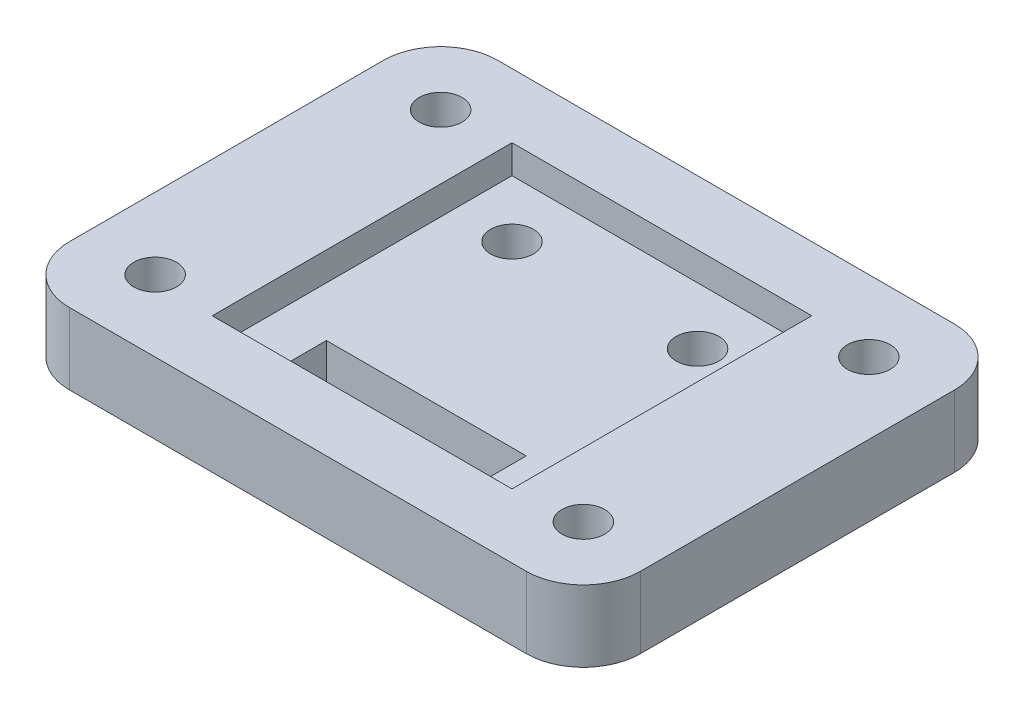
from build123d import *

# Parameters (mm, degrees)
SKETCH1_W           = 40
SKETCH1_H           = 30
BOSS_EXTRUDE1_DEPTH = 5
SKETCH2_W           = 21
SKETCH2_H           = 21
CUT_EXTRUDE1_DEPTH  = 2
SKETCH3_W           = 14
SKETCH3_H           = 3
CUT_EXTRUDE2_DEPTH  = 3
SKETCH4_R           = 1.5
CUT_EXTRUDE3_DEPTH  = 3
SKETCH5_R           = 1.5
CUT_EXTRUDE4_DEPTH  = 5
FILLET1_R           = 4


with BuildPart() as part:
    # Sketch1 → Boss-Extrude1 (new body)
    with BuildSketch(Plane(origin=(0, 0, 0), x_dir=(1, 0, 0), z_dir=(0, 1, 0))):
        with Locations((20, 15)):
            Rectangle(SKETCH1_W, SKETCH1_H)
    extrude(amount=BOSS_EXTRUDE1_DEPTH)

    # Sketch2 → Cut-Extrude1 (cut)
    with BuildSketch(Plane(origin=(0, 5, 0), x_dir=(1, 0, 0), z_dir=(0, 1, 0))):
        with Locations((20, 15)):
            Rectangle(SKETCH2_W, SKETCH2_H)
    extrude(amount=-CUT_EXTRUDE1_DEPTH, mode=Mode.SUBTRACT)

    # Sketch3 → Cut-Extrude2 (cut)
    with BuildSketch(Plane(origin=(0, 3, 0), x_dir=(1, 0, 0), z_dir=(0, 1, 0))):
        with Locations((20, 7.5)):
            Rectangle(SKETCH3_W, SKETCH3_H)
    extrude(amount=-CUT_EXTRUDE2_DEPTH, mode=Mode.SUBTRACT)

    # Sketch4 → Cut-Extrude3 (cut)
    with BuildSketch(Plane(origin=(0, 3, 0), x_dir=(1, 0, 0), z_dir=(0, 1, 0))):
        with Locations(Location((13.5, 21.5, 0), (0, 0, 270))):
            Circle(SKETCH4_R)
        with Locations(Location((26.5, 21.5, 0), (0, 0, 270))):
            Circle(SKETCH4_R)
    extrude(amount=-CUT_EXTRUDE3_DEPTH, mode=Mode.SUBTRACT)

    # Sketch5 → Cut-Extrude4 (cut)
    with BuildSketch(Plane(origin=(0, 5, 0), x_dir=(1, 0, 0), z_dir=(0, 1, 0))):
        with Locations(Location((5, 25, 0), (0, 0, 90))):
            Circle(SKETCH5_R)
        with Locations(Location((35, 5, 0), (0, 0, 90))):
            Circle(SKETCH5_R)
        with Locations(Location((35, 25, 0), (0, 0, 270))):
            Circle(SKETCH5_R)
        with Locations(Location((5, 5, 0), (0, 0, 270))):
            Circle(SKETCH5_R)
    extrude(amount=-CUT_EXTRUDE4_DEPTH, mode=Mode.SUBTRACT)

    # Fillet1
    fillet1_edges = [part.edges().sort_by_distance(p)[0] for p in [
        (0, 2.5, -30),
        (40, 2.5, -30),
        (40, 2.5, 0),
        (0, 2.5, 0),
    ]]
    fillet(fillet1_edges, radius=FILLET1_R)


solid = part.part
